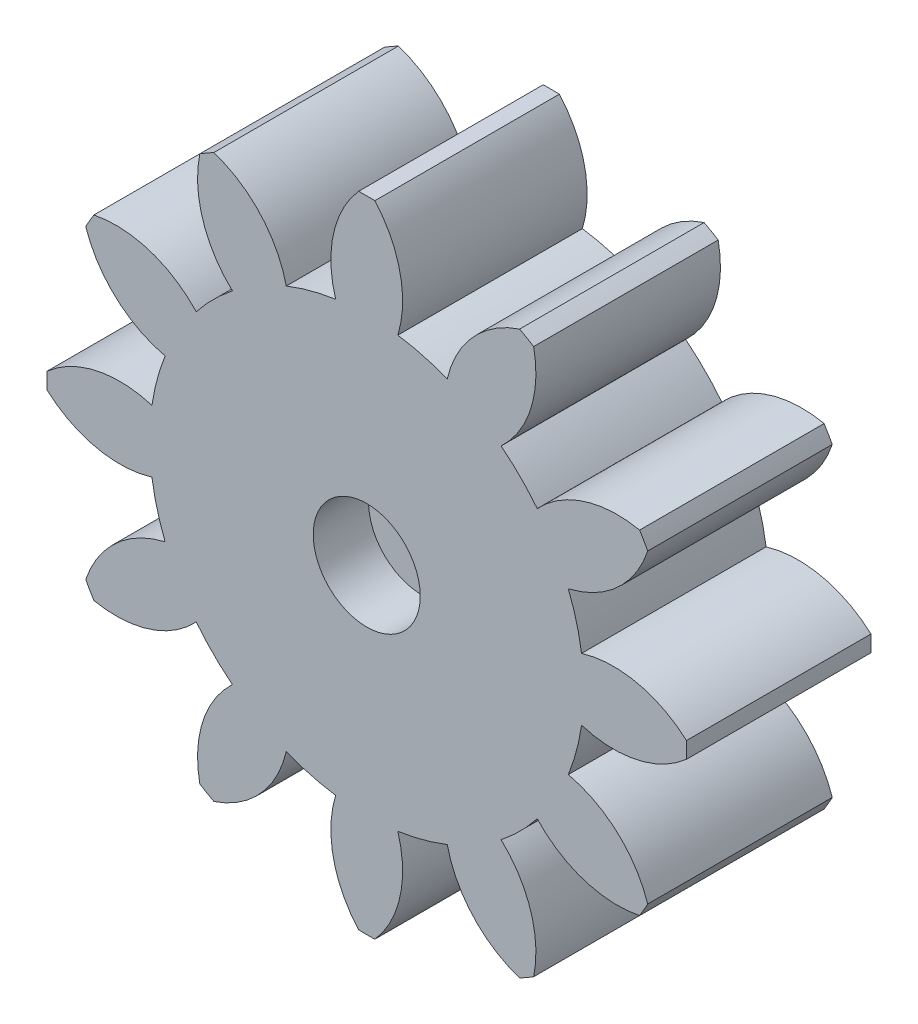
from build123d import *

# Parameters (mm, degrees)
BOSS_EXTRUDE1_DEPTH = 10
SKETCH3_R           = 2.9
CUT_EXTRUDE1_DEPTH  = 3
CUT_EXTRUDE2_START  = -5
SKETCH4_R           = 2.9
CUT_EXTRUDE2_DEPTH  = 5
CUT_EXTRUDE3_REACH  = 27.021
SKETCH5_R           = 1.125
CUT_EXTRUDE4_DEPTH  = 0.4


with BuildPart() as part:
    # Sketch1 → Boss-Extrude1 (new body)
    with BuildSketch(Plane.XY):
        with BuildLine():
            ThreePointArc((10.92443124, -4.361437941), (11.362069294, -3.044457292), (11.641553947, -1.685099566))
            ThreePointArc((11.641553947, -1.685099566), (14.648632583, -1.806960077), (17.329910897, -0.440168758))
            ThreePointArc((17.329910897, -0.440168758), (17.3355, 0), (17.329910897, 0.440168758))
            ThreePointArc((17.329910897, 0.440168758), (14.648632583, 1.806960077), (11.641553947, 1.685099566))
            ThreePointArc((11.641553947, 1.685099566), (11.362069294, 3.044457292), (10.92443124, 4.361437941))
            ThreePointArc((10.92443124, 4.361437941), (13.589567986, 5.759442961), (15.228227462, 8.283758122))
            ThreePointArc((15.228227462, 8.283758122), (15.012983387, 8.66775), (14.788058703, 9.046152775))
            ThreePointArc((14.788058703, 9.046152775), (11.782607909, 8.889189622), (9.239331674, 7.280116005))
            ThreePointArc((9.239331674, 7.280116005), (8.317612002, 8.317612002), (7.280116005, 9.239331674))
            ThreePointArc((7.280116005, 9.239331674), (8.889189622, 11.782607909), (9.046152775, 14.788058703))
            ThreePointArc((9.046152775, 14.788058703), (8.66775, 15.012983387), (8.283758122, 15.228227462))
            ThreePointArc((8.283758122, 15.228227462), (5.759442961, 13.589567986), (4.361437941, 10.92443124))
            ThreePointArc((4.361437941, 10.92443124), (3.044457292, 11.362069294), (1.685099566, 11.641553947))
            ThreePointArc((1.685099566, 11.641553947), (1.806960077, 14.648632583), (0.440168758, 17.329910897))
            ThreePointArc((0.440168758, 17.329910897), (0, 17.3355), (-0.440168758, 17.329910897))
            ThreePointArc((-0.440168758, 17.329910897), (-1.806960077, 14.648632583), (-1.685099566, 11.641553947))
            ThreePointArc((-1.685099566, 11.641553947), (-3.044457292, 11.362069294), (-4.361437941, 10.92443124))
            ThreePointArc((-4.361437941, 10.92443124), (-5.759442961, 13.589567986), (-8.283758122, 15.228227462))
            ThreePointArc((-8.283758122, 15.228227462), (-8.66775, 15.012983387), (-9.046152775, 14.788058703))
            ThreePointArc((-9.046152775, 14.788058703), (-8.889189622, 11.782607909), (-7.280116005, 9.239331674))
            ThreePointArc((-7.280116005, 9.239331674), (-8.317612002, 8.317612002), (-9.239331674, 7.280116005))
            ThreePointArc((-9.239331674, 7.280116005), (-11.782607909, 8.889189622), (-14.788058703, 9.046152775))
            ThreePointArc((-14.788058703, 9.046152775), (-15.012983387, 8.66775), (-15.228227462, 8.283758122))
            ThreePointArc((-15.228227462, 8.283758122), (-13.589567986, 5.759442961), (-10.92443124, 4.361437941))
            ThreePointArc((-10.92443124, 4.361437941), (-11.362069294, 3.044457292), (-11.641553947, 1.685099566))
            ThreePointArc((-11.641553947, 1.685099566), (-14.648632583, 1.806960077), (-17.329910897, 0.440168758))
            ThreePointArc((-17.329910897, 0.440168758), (-17.3355, 0), (-17.329910897, -0.440168758))
            ThreePointArc((-17.329910897, -0.440168758), (-14.648632583, -1.806960077), (-11.641553947, -1.685099566))
            ThreePointArc((-11.641553947, -1.685099566), (-11.362069294, -3.044457292), (-10.92443124, -4.361437941))
            ThreePointArc((-10.92443124, -4.361437941), (-13.589567986, -5.759442961), (-15.228227462, -8.283758122))
            ThreePointArc((-15.228227462, -8.283758122), (-15.012983387, -8.66775), (-14.788058703, -9.046152775))
            ThreePointArc((-14.788058703, -9.046152775), (-11.782607909, -8.889189622), (-9.239331674, -7.280116005))
            ThreePointArc((-9.239331674, -7.280116005), (-8.317612002, -8.317612002), (-7.280116005, -9.239331674))
            ThreePointArc((-7.280116005, -9.239331674), (-8.889189622, -11.782607909), (-9.046152775, -14.788058703))
            ThreePointArc((-9.046152775, -14.788058703), (-8.66775, -15.012983387), (-8.283758122, -15.228227462))
            ThreePointArc((-8.283758122, -15.228227462), (-5.759442961, -13.589567986), (-4.361437941, -10.92443124))
            ThreePointArc((-4.361437941, -10.92443124), (-3.044457292, -11.362069294), (-1.685099566, -11.641553947))
            ThreePointArc((-1.685099566, -11.641553947), (-1.806960077, -14.648632583), (-0.440168758, -17.329910897))
            ThreePointArc((-0.440168758, -17.329910897), (0, -17.3355), (0.440168758, -17.329910897))
            ThreePointArc((0.440168758, -17.329910897), (1.806960077, -14.648632583), (1.685099566, -11.641553947))
            ThreePointArc((1.685099566, -11.641553947), (3.044457292, -11.362069294), (4.361437941, -10.92443124))
            ThreePointArc((4.361437941, -10.92443124), (5.759442961, -13.589567986), (8.283758122, -15.228227462))
            ThreePointArc((8.283758122, -15.228227462), (8.66775, -15.012983387), (9.046152775, -14.788058703))
            ThreePointArc((9.046152775, -14.788058703), (8.889189622, -11.782607909), (7.280116005, -9.239331674))
            ThreePointArc((7.280116005, -9.239331674), (8.317612002, -8.317612002), (9.239331674, -7.280116005))
            ThreePointArc((9.239331674, -7.280116005), (11.782607909, -8.889189622), (14.788058703, -9.046152775))
            ThreePointArc((14.788058703, -9.046152775), (15.012983387, -8.66775), (15.228227462, -8.283758122))
            ThreePointArc((15.228227462, -8.283758122), (13.589567986, -5.759442961), (10.92443124, -4.361437941))
        make_face()
    extrude(amount=BOSS_EXTRUDE1_DEPTH)

    # Sketch3 → Cut-Extrude1 (cut)
    with BuildSketch(Plane.XY.offset(10)):
        Circle(SKETCH3_R)
    extrude(amount=-CUT_EXTRUDE1_DEPTH, mode=Mode.SUBTRACT)

    # Sketch4 → Cut-Extrude2 (cut)
    with BuildSketch(Plane(origin=(0, 0, 0), x_dir=(-1, 0, 0), z_dir=(0, 0, -1)).offset(CUT_EXTRUDE2_START)):
        with Locations(Location((0, 0, 0), (0, 0, 180))):
            Circle(SKETCH4_R)
    extrude(amount=CUT_EXTRUDE2_DEPTH, mode=Mode.SUBTRACT)

    # Sketch5 → Cut-Extrude3 (cut, up to next)
    with BuildSketch(Plane(origin=(0, 0, 5), x_dir=(-1, 0, 0), z_dir=(0, 0, -1)), mode=Mode.PRIVATE) as cut_extrude3_sk1:
        Circle(SKETCH5_R)
    cut_extrude3_tool1 = extrude(cut_extrude3_sk1.sketch, amount=-CUT_EXTRUDE3_REACH, mode=Mode.PRIVATE) & part.part
    add(cut_extrude3_tool1.solids().sort_by_distance((0, 0, 5))[0], mode=Mode.SUBTRACT)

    # Sketch6 → Cut-Extrude4 (cut)
    # profile 1 of 3: a face of its own
    with BuildSketch(Plane(origin=(0, 0, 0), x_dir=(-1, 0, 0), z_dir=(0, 0, -1))):
        Polygon((-2.618216479, 7.598722954), (-1.369925881, 7.598722954), (-1.397062633, 7.408765689), (-1.914356971, 7.408765689), (-2.18275641, 5.482056288), (-2.37398571, 5.482056288), (-2.105586271, 7.408765689), (-2.645353231, 7.408765689), align=None)
    # profile 2 of 3: a face of its own
    with BuildSketch(Plane(origin=(0, 0, 0), x_dir=(-1, 0, 0), z_dir=(0, 0, -1))):
        with BuildLine():
            add(Edge.make_bspline(
                [(-0.466780849, 7.055987912), (-0.450230711, 7.05582637), (-0.417344464, 7.055505377), (-0.368540996, 7.050389965), (-0.320631892, 7.043455272), (-0.273890681, 7.033209653), (-0.228274333, 7.020039405), (-0.183797047, 7.003718771), (-0.139886963, 6.985373988), (-0.097861943, 6.963061744), (-0.056959643, 6.93914658), (-0.018469172, 6.912248414), (0.018217553, 6.883553528), (0.05209848, 6.852068656), (0.083565028, 6.818384713), (0.113001423, 6.782640371), (0.140098105, 6.744546559), (0.164595462, 6.704227452), (0.186767697, 6.662267959), (0.205810076, 6.618582201), (0.221812473, 6.573454595), (0.235635063, 6.527284032), (0.245748638, 6.479469202), (0.252716265, 6.430299353), (0.25780439, 6.379794636), (0.25811986, 6.345639936), (0.258279247, 6.328383745)],
                knots=[0, 0, 0, 0, 1.03627571, 2.059150084, 3.070927706, 4.06779616, 5.054149748, 6.042845231, 7.034549244, 8.032518082, 9.021054968, 10.001029484, 10.971760647, 11.936659593, 12.895077573, 13.857576725, 14.835388912, 15.8209076, 16.811029316, 17.806244914, 18.80327064, 19.809103321, 20.823280083, 21.861332084, 22.919467504, 24, 24, 24, 24], degree=3))
            add(Edge.make_bspline(
                [(0.258279247, 6.328383745), (0.258039783, 6.308578593), (0.257564863, 6.269299702), (0.25111703, 6.210994824), (0.242013556, 6.153590639), (0.228820877, 6.097203636), (0.211893663, 6.041919503), (0.190810327, 5.98797899), (0.166897365, 5.934727262), (0.138391513, 5.883395436), (0.107072302, 5.833870752), (0.073382761, 5.786755537), (0.036549617, 5.742935538), (-0.002372315, 5.701702817), (-0.04403848, 5.66345401), (-0.088426282, 5.628104243), (-0.135229578, 5.595522836), (-0.184676123, 5.566327033), (-0.235762168, 5.539867628), (-0.289219479, 5.517520108), (-0.344037548, 5.497877287), (-0.400776526, 5.482306102), (-0.458924002, 5.469780542), (-0.519048579, 5.461676665), (-0.580721407, 5.455726724), (-0.622519609, 5.455190096), (-0.643593749, 5.454919536)],
                knots=[0, 0, 0, 0, 1.017087327, 2.017155118, 3.010450244, 4.002177923, 4.98990937, 5.978441356, 6.976106943, 7.986874878, 8.992202068, 9.985815693, 10.9602433, 11.931092427, 12.89734067, 13.863616201, 14.844651087, 15.824798608, 16.812129542, 17.798097515, 18.799509077, 19.80202592, 20.818957686, 21.853141412, 22.917580209, 24, 24, 24, 24], degree=3))
            add(Edge.make_bspline(
                [(-0.643593749, 5.454919536), (-0.669493428, 5.455383045), (-0.720215087, 5.456290778), (-0.79439634, 5.466548474), (-0.865066012, 5.482132761), (-0.932596844, 5.503609688), (-0.996247222, 5.532258194), (-1.056572504, 5.566773789), (-1.113195168, 5.607790827), (-1.165981922, 5.654584393), (-1.213474215, 5.70648827), (-1.255599117, 5.761915733), (-1.290839566, 5.821150442), (-1.31984552, 5.88380972), (-1.342346636, 5.949908511), (-1.358542659, 6.019333173), (-1.367836177, 6.092239873), (-1.369220429, 6.141933883), (-1.369925881, 6.167259279)],
                knots=[0, 0, 0, 0, 1.089556378, 2.133775721, 3.145629624, 4.13340939, 5.110814317, 6.078263757, 7.054146471, 8.048729294, 9.042457604, 10.011040595, 10.974236523, 11.937854973, 12.912449201, 13.908223557, 14.933974817, 16, 16, 16, 16], degree=3))
            add(Edge.make_bspline(
                [(-1.369925881, 6.167259279), (-1.369686634, 6.187346849), (-1.369212104, 6.227189251), (-1.362759891, 6.286341002), (-1.353696191, 6.344455032), (-1.340515163, 6.40142391), (-1.323365754, 6.45698532), (-1.303239948, 6.51160935), (-1.278207847, 6.564567741), (-1.250581409, 6.616609619), (-1.219162465, 6.666555184), (-1.184856791, 6.713974777), (-1.147928001, 6.75876754), (-1.107808488, 6.800408128), (-1.065080124, 6.839424555), (-1.019448587, 6.875464179), (-0.9715212, 6.909223719), (-0.920623878, 6.939512396), (-0.868016329, 6.966960034), (-0.813961342, 6.990907617), (-0.758740152, 7.010651127), (-0.702629226, 7.02747186), (-0.645186655, 7.040029408), (-0.586743519, 7.049425439), (-0.527104511, 7.055120684), (-0.487004359, 7.055697173), (-0.466780849, 7.055987912)],
                knots=[0, 0, 0, 0, 1.024713341, 2.032452976, 3.033353726, 4.025482262, 5.013511511, 5.999616649, 6.993631463, 8.000544617, 9.005259126, 10.002305436, 10.98592741, 11.965467619, 12.950965753, 13.936701455, 14.931265759, 15.94073365, 16.957033976, 17.958246597, 18.955397277, 19.948259791, 20.945827841, 21.953851424, 22.96807607, 24, 24, 24, 24], degree=3))
        make_face()
        with BuildLine():
            add(Edge.make_bspline(
                [(-0.472293002, 6.866030647), (-0.503747094, 6.865022695), (-0.566133209, 6.863023522), (-0.658065178, 6.845395471), (-0.74697014, 6.81671419), (-0.8179001, 6.783908088), (-0.872314578, 6.752977498), (-0.910614571, 6.727193913), (-0.946742967, 6.69944908), (-0.979981554, 6.669196258), (-1.011627398, 6.637641618), (-1.040171419, 6.603265542), (-1.066329268, 6.566962809), (-1.097983096, 6.516104928), (-1.130880322, 6.448766532), (-1.159486048, 6.363291926), (-1.176996833, 6.273551961), (-1.178969506, 6.212282932), (-1.179968616, 6.181251667)],
                knots=[0, 0, 0, 0, 1.372743697, 2.722702845, 4.071645436, 5.444389132, 6.127359067, 6.803628796, 7.459271053, 8.114942369, 8.765332867, 9.409483052, 10.063932782, 10.718266051, 12.024090525, 13.326115932, 14.645743067, 16, 16, 16, 16], degree=3))
            add(Edge.make_bspline(
                [(-1.179968616, 6.181251667), (-1.1794568, 6.161867569), (-1.178451954, 6.123810792), (-1.171245103, 6.068109016), (-1.158915609, 6.015297828), (-1.141843388, 5.965306456), (-1.120166741, 5.91788484), (-1.093381959, 5.873158688), (-1.061329114, 5.831519246), (-1.024961279, 5.793010338), (-0.984651842, 5.758346576), (-0.941503542, 5.727691836), (-0.895161957, 5.701906395), (-0.845807108, 5.681429065), (-0.794011633, 5.664525813), (-0.73908174, 5.653428903), (-0.681546468, 5.645797717), (-0.642065378, 5.645187438), (-0.62196915, 5.644876801)],
                knots=[0, 0, 0, 0, 1.069610863, 2.09996579, 3.093251973, 4.057699662, 5.010501648, 5.965599547, 6.928152941, 7.9047617, 8.883610534, 9.857443192, 10.821102044, 11.803301409, 12.802328473, 13.822685622, 14.891727543, 16, 16, 16, 16], degree=3))
            add(Edge.make_bspline(
                [(-0.62196915, 5.644876801), (-0.590524141, 5.645933886), (-0.528763332, 5.648010096), (-0.438477158, 5.664456418), (-0.352929935, 5.691901598), (-0.272103007, 5.729454032), (-0.197778454, 5.777916968), (-0.130845563, 5.836279067), (-0.071984641, 5.904158073), (-0.022332757, 5.980832092), (0.017761416, 6.063614509), (0.047409032, 6.150361963), (0.064739616, 6.24049149), (0.067121094, 6.301457184), (0.068321982, 6.332199851)],
                knots=[0, 0, 0, 0, 1.041031538, 2.044679016, 3.027709902, 4.009904446, 4.987626416, 5.956465705, 6.942045831, 7.953523378, 8.973157787, 9.981293248, 10.982043401, 12, 12, 12, 12], degree=3))
            add(Edge.make_bspline(
                [(0.068321982, 6.332199851), (0.067596039, 6.357703768), (0.066178212, 6.407515064), (0.052490613, 6.479882494), (0.031000633, 6.547823061), (0.000738925, 6.610911353), (-0.037430539, 6.668381502), (-0.083276432, 6.719204496), (-0.136040802, 6.763624821), (-0.195880428, 6.799826465), (-0.259971579, 6.829850478), (-0.328268896, 6.850426904), (-0.399271241, 6.863689881), (-0.447781945, 6.865244927), (-0.472293002, 6.866030647)],
                knots=[0, 0, 0, 0, 1.077193536, 2.103849527, 3.101581798, 4.082405951, 5.051880133, 6.008097985, 6.966702469, 7.956675201, 8.956587919, 9.95073534, 10.96456583, 12, 12, 12, 12], degree=3))
        make_face(mode=Mode.SUBTRACT)
    # profile 3 of 3: a face of its own
    with BuildSketch(Plane(origin=(0, 0, 0), x_dir=(-1, 0, 0), z_dir=(0, 0, -1))):
        with BuildLine():
            Line((0.776421608, 7.02885116), (0.967650909, 7.02885116))
            Line((0.967650909, 7.02885116), (0.932457933, 6.781228296))
            add(Edge.make_bspline(
                [(0.932457933, 6.781228296), (0.95525764, 6.803138201), (1.000002938, 6.846137227), (1.072430641, 6.902257527), (1.147347384, 6.949518214), (1.224612839, 6.988624493), (1.304555777, 7.018705794), (1.386761654, 7.040508587), (1.471519696, 7.05361281), (1.528855179, 7.05518975), (1.557875268, 7.055987912)],
                knots=[0, 0, 0, 0, 1.080491695, 2.120506346, 3.125967587, 4.104895448, 5.075956364, 6.040563774, 7.008240457, 8, 8, 8, 8], degree=3))
            add(Edge.make_bspline(
                [(1.557875268, 7.055987912), (1.584192867, 7.055471337), (1.635869811, 7.054456997), (1.711516019, 7.044905152), (1.783549539, 7.029392819), (1.851757058, 7.00707545), (1.916555994, 6.979203097), (1.97753369, 6.944637972), (2.03469906, 6.903571981), (2.087708757, 6.856739674), (2.136102849, 6.805245178), (2.178144461, 6.749427894), (2.214259749, 6.690243954), (2.242868415, 6.626972477), (2.266096403, 6.56066932), (2.282154079, 6.490571495), (2.29146759, 6.416830902), (2.292836344, 6.366430373), (2.293535658, 6.340680086)],
                knots=[0, 0, 0, 0, 1.096505685, 2.153086291, 3.17225003, 4.163343266, 5.139547915, 6.107720758, 7.078792705, 8.068010811, 9.051652642, 10.018964823, 10.975725472, 11.935220788, 12.907721202, 13.899444527, 14.92679881, 16, 16, 16, 16], degree=3))
            add(Edge.make_bspline(
                [(2.293535658, 6.340680086), (2.292756814, 6.310809362), (2.291221368, 6.2519209), (2.277974073, 6.16544013), (2.257296292, 6.082130479), (2.227913966, 6.001855526), (2.189452999, 5.925007168), (2.142976411, 5.851323822), (2.088249202, 5.780811596), (2.025651473, 5.714800282), (1.957599549, 5.654160368), (1.885694396, 5.600858306), (1.810960661, 5.555646543), (1.732910767, 5.518855238), (1.65201047, 5.489939258), (1.567893547, 5.469515219), (1.480912029, 5.457505724), (1.421945993, 5.455788903), (1.392086673, 5.454919536)],
                knots=[0, 0, 0, 0, 1.022089159, 2.01499164, 2.987849783, 3.956837769, 4.934916078, 5.924287168, 6.934719411, 7.985541157, 9.034300007, 10.051394906, 11.045510982, 12.01949953, 13.000493772, 13.981583472, 14.977910841, 16, 16, 16, 16], degree=3))
            add(Edge.make_bspline(
                [(1.392086673, 5.454919536), (1.36008557, 5.455877278), (1.297702186, 5.457744315), (1.207264878, 5.472815489), (1.122821871, 5.497537928), (1.043999269, 5.531754612), (0.971349306, 5.577623514), (0.904405343, 5.634036542), (0.843202, 5.701632583), (0.80859248, 5.752958596), (0.790838008, 5.779288526)],
                knots=[0, 0, 0, 0, 1.071471759, 2.088741615, 3.060992147, 4.012786182, 4.957251705, 5.92834886, 6.937255634, 8, 8, 8, 8], degree=3))
            Line((0.790838008, 5.779288526), (0.6678746, 4.912184493))
            Line((0.6678746, 4.912184493), (0.4766453, 4.912184493))
            Line((0.4766453, 4.912184493), (0.776421608, 7.02885116))
        make_face()
        with BuildLine():
            add(Edge.make_bspline(
                [(1.548547009, 6.866030647), (1.516964336, 6.86495289), (1.454651685, 6.862826475), (1.363186083, 6.846486382), (1.276118948, 6.818599665), (1.207326109, 6.786791703), (1.155258156, 6.75620511), (1.117925825, 6.730978147), (1.083157103, 6.70275848), (1.050269418, 6.672479986), (1.01928348, 6.639844547), (0.99047575, 6.604727345), (0.964099599, 6.567007331), (0.931552528, 6.514374386), (0.897108756, 6.44482235), (0.867718491, 6.356677676), (0.849813634, 6.264798947), (0.847534749, 6.202249068), (0.846383548, 6.170651373)],
                knots=[0, 0, 0, 0, 1.373302579, 2.709527635, 4.025818017, 5.340600036, 5.996436859, 6.651235509, 7.298369999, 7.942284166, 8.594596046, 9.254254176, 9.916057447, 10.595111869, 11.945097863, 13.280714634, 14.626325921, 16, 16, 16, 16], degree=3))
            add(Edge.make_bspline(
                [(0.846383548, 6.170651373), (0.846880401, 6.151687835), (0.84785555, 6.1144691), (0.855281967, 6.059969025), (0.866935692, 6.008041586), (0.883890562, 5.958899419), (0.90645881, 5.912918133), (0.93249753, 5.868896771), (0.964183934, 5.827973452), (1.000712796, 5.790469527), (1.040674711, 5.756302458), (1.083765653, 5.726286707), (1.129952142, 5.701296184), (1.178658217, 5.680303519), (1.230520431, 5.664740354), (1.284990487, 5.653397445), (1.342265236, 5.645810225), (1.3814616, 5.645191678), (1.401414931, 5.644876801)],
                knots=[0, 0, 0, 0, 1.059539084, 2.079501421, 3.068245832, 4.030023329, 4.976860763, 5.926494777, 6.883948341, 7.861554922, 8.847708594, 9.818397607, 10.790499747, 11.777918043, 12.777395323, 13.81072841, 14.885527747, 16, 16, 16, 16], degree=3))
            add(Edge.make_bspline(
                [(1.401414931, 5.644876801), (1.425190397, 5.645401392), (1.472082588, 5.64643604), (1.540974967, 5.655997841), (1.607293902, 5.671745595), (1.67090799, 5.693830093), (1.732023507, 5.721998881), (1.790365132, 5.756406863), (1.845607091, 5.797691261), (1.898274519, 5.843733104), (1.9462516, 5.894713202), (1.988627243, 5.949036817), (2.023867858, 6.006842659), (2.053425248, 6.067025352), (2.075840269, 6.130254393), (2.092225689, 6.196099235), (2.101446629, 6.26494454), (2.102861119, 6.311821231), (2.103578393, 6.335591945)],
                knots=[0, 0, 0, 0, 1.040175975, 2.051532087, 3.037326676, 4.019426442, 4.993721473, 5.978273039, 6.97798342, 8.008029491, 9.036439563, 10.03746972, 11.017814446, 11.994463325, 12.966949882, 13.948192021, 14.959548133, 16, 16, 16, 16], degree=3))
            add(Edge.make_bspline(
                [(2.103578393, 6.335591945), (2.103084075, 6.35497875), (2.102117155, 6.392900654), (2.094707841, 6.448394989), (2.082931157, 6.501085061), (2.066543011, 6.550976382), (2.044636177, 6.59774105), (2.017611356, 6.641345196), (1.986861031, 6.682940214), (1.950483335, 6.720388688), (1.910955275, 6.754734057), (1.867876985, 6.784605186), (1.821707243, 6.809606077), (1.772885678, 6.830695088), (1.720831223, 6.846087633), (1.666111937, 6.857566749), (1.608400351, 6.865104242), (1.568782329, 6.865717446), (1.548547009, 6.866030647)],
                knots=[0, 0, 0, 0, 1.076738842, 2.106174048, 3.10432078, 4.072684072, 5.017588714, 5.965620031, 6.918839682, 7.885163507, 8.859461406, 9.824348649, 10.790640573, 11.77215711, 12.773171864, 13.80032876, 14.876494868, 16, 16, 16, 16], degree=3))
        make_face(mode=Mode.SUBTRACT)
    extrude(amount=-CUT_EXTRUDE4_DEPTH, mode=Mode.SUBTRACT)


solid = part.part
